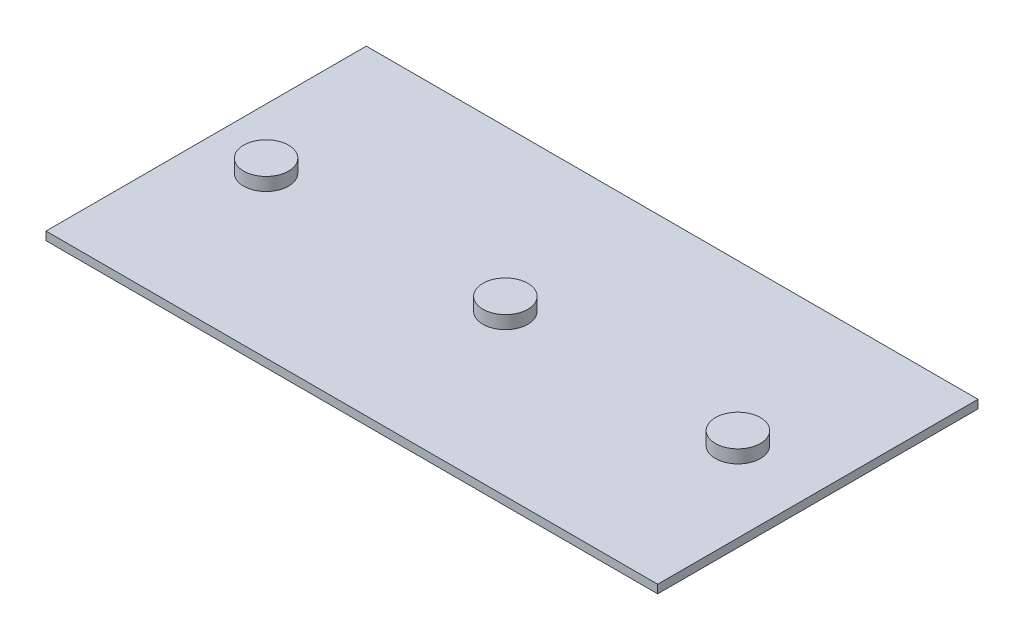
from build123d import *

# Parameters (mm, degrees)
ESQUISSE1_W        = 117.07
ESQUISSE1_H        = 61.3
BOSS_EXTRU_1_DEPTH = 1.6
ESQUISSE2_W        = 15
ESQUISSE2_H        = 15.6
BOSS_EXTRU_2_DEPTH = 4
ESQUISSE3_R        = 4.3
BOSS_EXTRU_3_DEPTH = 2.5


with BuildPart() as part:
    # Esquisse1 → Boss.-Extru.1 (new body)
    with BuildSketch(Plane(origin=(0, 0, 0), x_dir=(1, 0, 0), z_dir=(0, 1, 0))):
        with Locations((58.535, -30.65)):
            Rectangle(ESQUISSE1_W, ESQUISSE1_H)
    extrude(amount=BOSS_EXTRU_1_DEPTH)

    # Esquisse2 → Boss.-Extru.2 (add)
    with BuildSketch(Plane.XZ):
        with Locations((101.57, 30.8)):
            Rectangle(ESQUISSE2_W, ESQUISSE2_H)
    extrude(amount=BOSS_EXTRU_2_DEPTH)

    # Esquisse3 → Boss.-Extru.3 (add)
    with BuildSketch(Plane(origin=(0, 1.6, 0), x_dir=(1, 0, 0), z_dir=(0, 1, 0))):
        with Locations(Location((101.77, -30.65, 0), (0, 0, 270))):
            Circle(ESQUISSE3_R)
        with Locations(Location((57.27, -30.65, 0), (0, 0, 270))):
            Circle(ESQUISSE3_R)
        with Locations(Location((11.47, -30.65, 0), (0, 0, 270))):
            Circle(ESQUISSE3_R)
    extrude(amount=BOSS_EXTRU_3_DEPTH)


solid = part.part
